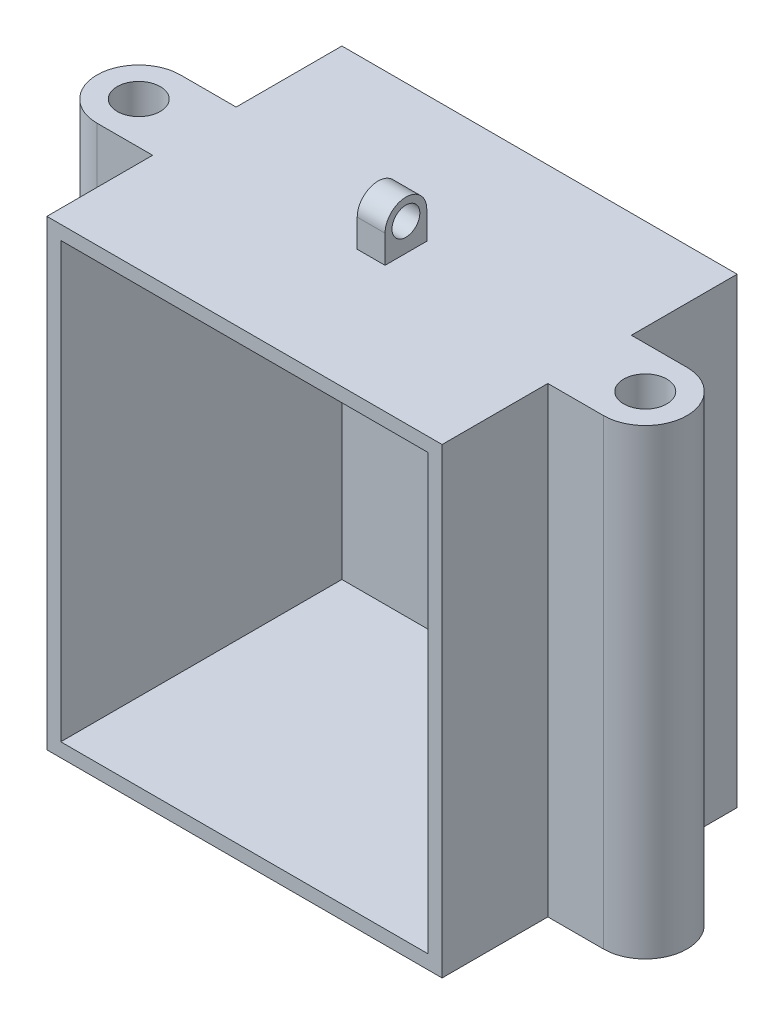
from build123d import *

# Parameters (mm, degrees)
SKETCH_2_W      = 142
SKETCH_2_H      = 166
EXTRUDE_1_DEPTH = 106
SHELL_1_T       = -5
SKETCH_3_R      = 15
SKETCH_3_R_2    = 7.75
EXTRUDE_2_DEPTH = 166
SKETCH_4_R      = 5
EXTRUDE_3_DEPTH = 5


with BuildPart() as part:
    # 스케치2 → 보스-돌출1 (new body)
    with BuildSketch(Plane.XY):
        with Locations((71, 83)):
            Rectangle(SKETCH_2_W, SKETCH_2_H)
    extrude(amount=EXTRUDE_1_DEPTH)

    # 쉘1
    shell_1_openings = [part.faces().sort_by_distance(p)[0] for p in [
        (71, 83, 106),
    ]]
    offset(amount=SHELL_1_T, openings=shell_1_openings, kind=Kind.INTERSECTION)

    # 스케치3 → 보스-돌출2 (add)
    # profile 1 of 4: a face of its own
    with BuildSketch(Plane(origin=(0, 166, 0), x_dir=(1, 0, 0), z_dir=(0, 1, 0))):
        with Locations((-20, -53)):
            Circle(SKETCH_3_R)
        with Locations(Location((-20, -53, 0), (0, 0, 270))):
            Circle(SKETCH_3_R_2, mode=Mode.SUBTRACT)
    # profile 2 of 4: a face of its own
    with BuildSketch(Plane(origin=(0, 166, 0), x_dir=(1, 0, 0), z_dir=(0, 1, 0))):
        with BuildLine():
            Line((0, -38), (-20, -38))
            ThreePointArc((-20, -38), (-9.393398282, -42.393398282), (-5, -53))
            ThreePointArc((-5, -53), (-9.393398282, -63.606601718), (-20, -68))
            Line((-20, -68), (0, -68))
            Line((0, -68), (0, -38))
        make_face()
    # profile 3 of 4: a face of its own
    with BuildSketch(Plane(origin=(0, 166, 0), x_dir=(1, 0, 0), z_dir=(0, 1, 0))):
        with BuildLine():
            ThreePointArc((162, -68), (147, -53), (162, -38))
            Line((162, -38), (142, -38))
            Line((142, -38), (142, -68))
            Line((142, -68), (162, -68))
        make_face()
    # profile 4 of 4: a face of its own
    with BuildSketch(Plane(origin=(0, 166, 0), x_dir=(1, 0, 0), z_dir=(0, 1, 0))):
        with Locations((162, -53)):
            Circle(SKETCH_3_R)
        with Locations(Location((162, -53, 0), (0, 0, 270))):
            Circle(SKETCH_3_R_2, mode=Mode.SUBTRACT)
    extrude(amount=-EXTRUDE_2_DEPTH)

    # 스케치4 → 보스-돌출3 (add, symmetric)
    with BuildSketch(Plane(origin=(71, 0, 0), x_dir=(0, 0, -1), z_dir=(1, 0, 0))):
        with BuildLine():
            ThreePointArc((-45.5, 176), (-53, 183.5), (-60.5, 176))
            Line((-60.5, 176), (-60.5, 166))
            Line((-60.5, 166), (-45.5, 166))
            Line((-45.5, 166), (-45.5, 176))
        make_face()
        with Locations((-53, 176)):
            Circle(SKETCH_4_R, mode=Mode.SUBTRACT)
    extrude(amount=EXTRUDE_3_DEPTH, both=True)


solid = part.part
